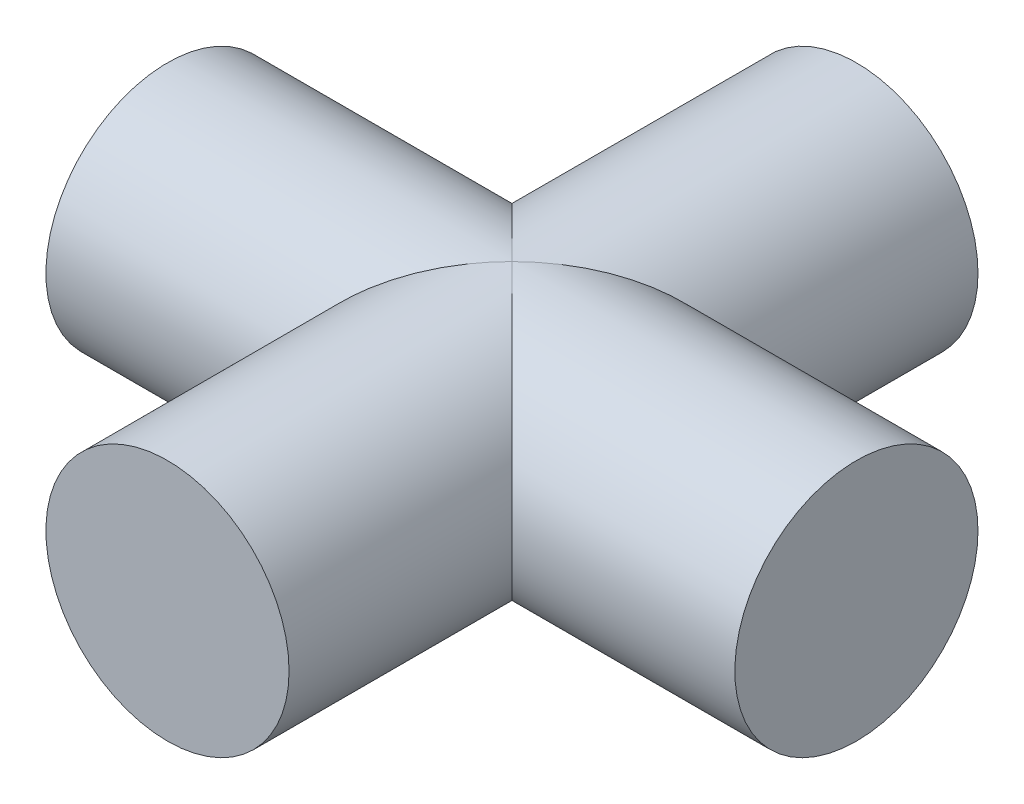
from build123d import *

# Parameters (mm, degrees)
SKETCH1_R           = 4.765
BOSS_EXTRUDE3_DEPTH = 13.5
SKETCH3_R           = 4.765
BOSS_EXTRUDE4_DEPTH = 13.5


with BuildPart() as part:
    # Sketch1 → Boss-Extrude3 (new, symmetric)
    with BuildSketch(Plane.XY):
        Circle(SKETCH1_R)
    extrude(amount=BOSS_EXTRUDE3_DEPTH, both=True)

    # Sketch3 → Boss-Extrude4 (add, symmetric)
    with BuildSketch(Plane(origin=(0, 0, 0), x_dir=(0, 0, -1), z_dir=(1, 0, 0))):
        with Locations(Location((0, 0, 0), (0, 0, 270))):
            Circle(SKETCH3_R)
    extrude(amount=BOSS_EXTRUDE4_DEPTH, both=True)


solid = part.part
